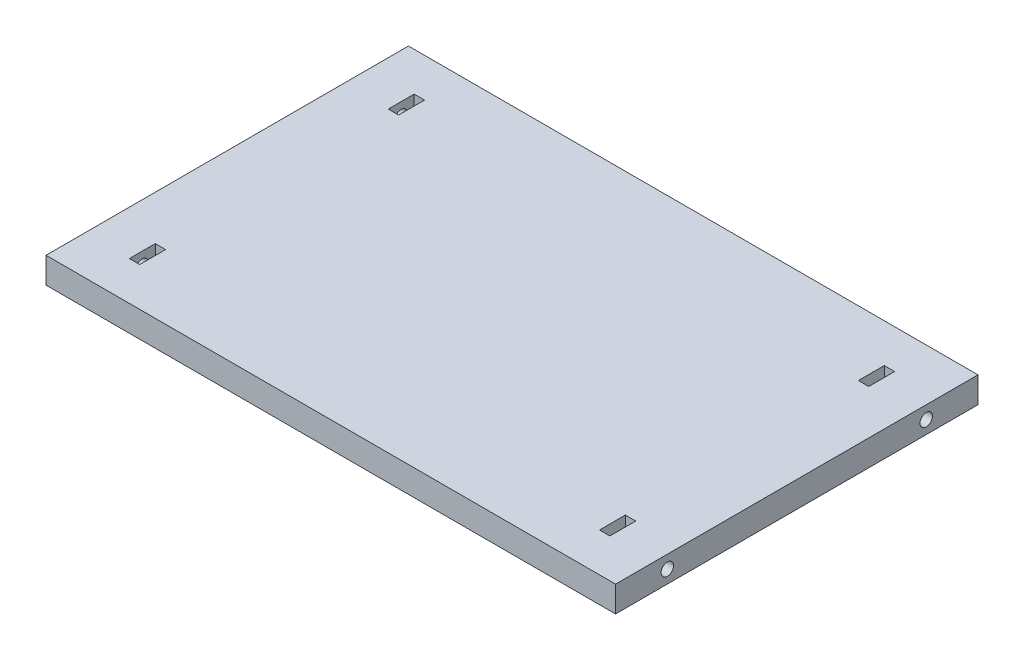
from build123d import *

# Parameters (mm, degrees)
SKETCH1_W                     = 110
SKETCH1_H                     = 5
BOSS_EXTRUDE1_DEPTH           = 70
M2_CLEARANCE_HOLE1_AT_2_COUNT = 2
M2_CLEARANCE_HOLE1_AT_2_PITCH = 50
SKETCH4_W                     = 2
SKETCH4_H                     = 5
CUT_EXTRUDE1_DEPTH            = 4.5


with BuildPart() as part:
    # Sketch1 → Boss-Extrude1 (new body)
    with BuildSketch(Plane.XY):
        with Locations((0, 16)):
            Rectangle(SKETCH1_W, SKETCH1_H)
    extrude(amount=BOSS_EXTRUDE1_DEPTH)

    # Sketch3 → M2 Clearance Hole1 (revolve, cut)
    with BuildSketch(Plane(origin=(-55, 16, 10), x_dir=(0, 0, 1), z_dir=(0, 1, 0))):
        Polygon((0, 0), (0, 9.721032743), (1.2, 9), (1.2, 0), align=None)
    m2_clearance_hole1 = revolve(axis=Axis((-61.35, 16, 10), (1, 0, 0)), mode=Mode.SUBTRACT)

    # M2 Clearance Hole1 at 2: M2 Clearance Hole1 ×2
    with Locations(*[(0, 0, i * M2_CLEARANCE_HOLE1_AT_2_PITCH) for i in range(1, M2_CLEARANCE_HOLE1_AT_2_COUNT)]):
        add(m2_clearance_hole1, mode=Mode.SUBTRACT)

    # Sketch4 → Cut-Extrude1 (cut)
    with BuildSketch(Plane(origin=(0, 18.5, 0), x_dir=(1, 0, 0), z_dir=(0, 1, 0))):
        with Locations((-45.4, -60)):
            Rectangle(SKETCH4_W, SKETCH4_H)
        with Locations((-45.4, -10)):
            Rectangle(SKETCH4_W, SKETCH4_H)
    cut_extrude1 = extrude(amount=-CUT_EXTRUDE1_DEPTH, mode=Mode.SUBTRACT)

    # Mirror1: M2 Clearance Hole1, Cut-Extrude1 across plane
    add(m2_clearance_hole1.mirror(Plane(origin=(0, 0, 0), x_dir=(0, 0, 1), z_dir=(1, 0, 0))), mode=Mode.SUBTRACT)
    add(cut_extrude1.mirror(Plane(origin=(0, 0, 0), x_dir=(0, 0, 1), z_dir=(1, 0, 0))), mode=Mode.SUBTRACT)

    # Mirror1 copy 1 sketch → Mirror1 copy 1 (revolve, cut)
    with BuildSketch(Plane(origin=(55, 16, 60), x_dir=(0, 0, 1), z_dir=(0, 1, 0))):
        Polygon((0, 0), (0, -9.721032743), (1.2, -9), (1.2, 0), align=None)
    revolve(axis=Axis((61.35, 16, 60), (1, 0, 0)), mode=Mode.SUBTRACT)


solid = part.part
